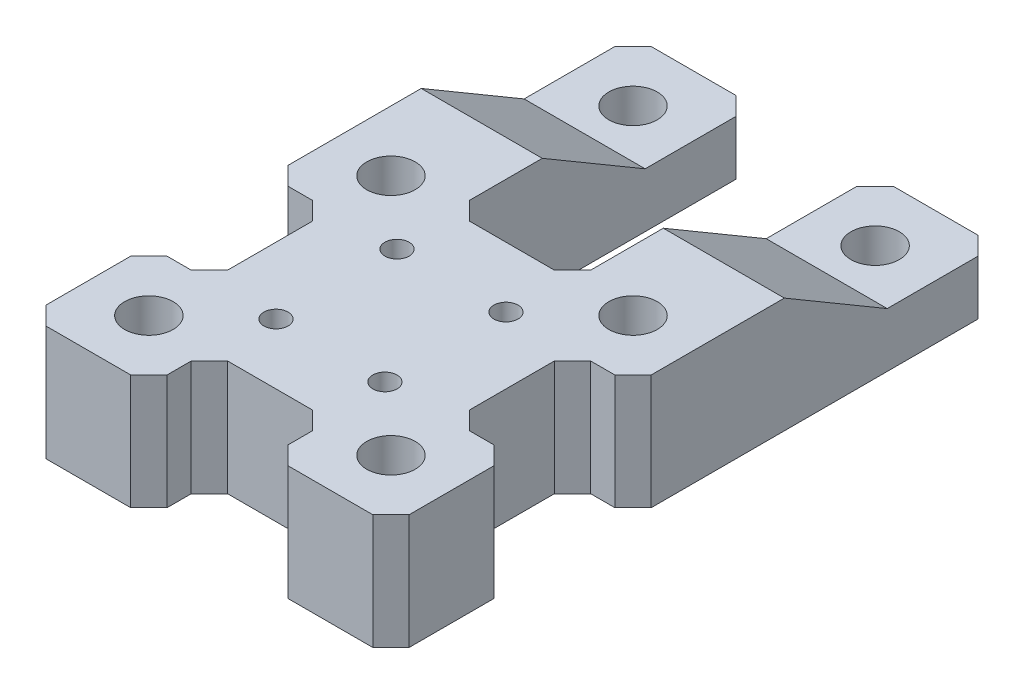
from build123d import *

# Parameters (mm, degrees)
SKETCH_1_W               = 60
SKETCH_1_H               = 100
SKETCH_1_R               = 4
SKETCH_1_R_2             = 2
EXTRUDE_1_DEPTH          = 19
SKETCH_3_W               = 20
SKETCH_3_H               = 50
SKETCH_3_H_2             = 10
SKETCH_3_W_2             = 10
SKETCH_3_H_3             = 20
CUT_EXTRUDE_1_DEPTH      = 62.326992426
CHAMFER_1_SIZE           = 3
CUT_EXTRUDE_2_DEPTH      = 62.326992426
CUT_EXTRUDE_2_DEPTH_BACK = 62.326992426


with BuildPart() as part:
    # 草图1 → 凸台-拉伸1 (new body)
    with BuildSketch(Plane(origin=(0, 0, 0), x_dir=(1, 0, 0), z_dir=(0, 1, 0))):
        Rectangle(SKETCH_1_W, SKETCH_1_H)
        with Locations(Location((-20, 0, 0), (0, 0, 270))):
            Circle(SKETCH_1_R, mode=Mode.SUBTRACT)
        with Locations(Location((20, 0, 0), (0, 0, 270))):
            Circle(SKETCH_1_R, mode=Mode.SUBTRACT)
        with Locations(Location((-20, -40, 0), (0, 0, 270))):
            Circle(SKETCH_1_R, mode=Mode.SUBTRACT)
        with Locations(Location((20, -40, 0), (0, 0, 270))):
            Circle(SKETCH_1_R, mode=Mode.SUBTRACT)
        with Locations(Location((-20, 40, 0), (0, 0, 270))):
            Circle(SKETCH_1_R, mode=Mode.SUBTRACT)
        with Locations(Location((20, 40, 0), (0, 0, 270))):
            Circle(SKETCH_1_R, mode=Mode.SUBTRACT)
        with Locations(Location((-9, -30, 0), (0, 0, 270))):
            Circle(SKETCH_1_R_2, mode=Mode.SUBTRACT)
        with Locations(Location((9, -30, 0), (0, 0, 270))):
            Circle(SKETCH_1_R_2, mode=Mode.SUBTRACT)
        with Locations(Location((-9, -10, 0), (0, 0, 270))):
            Circle(SKETCH_1_R_2, mode=Mode.SUBTRACT)
        with Locations(Location((9, -10, 0), (0, 0, 270))):
            Circle(SKETCH_1_R_2, mode=Mode.SUBTRACT)
    extrude(amount=EXTRUDE_1_DEPTH)

    # 草图3 → 切除-拉伸1 (cut, through all)
    with BuildSketch(Plane(origin=(0, 0, 0), x_dir=(1, 0, 0), z_dir=(0, 1, 0))):
        with Locations((0, 25)):
            Rectangle(SKETCH_3_W, SKETCH_3_H)
        with Locations((0, -45)):
            Rectangle(SKETCH_3_W, SKETCH_3_H_2)
        with Locations((-25, -20)):
            Rectangle(SKETCH_3_W_2, SKETCH_3_H_3)
        with Locations((25, -20)):
            Rectangle(SKETCH_3_W_2, SKETCH_3_H_3)
    extrude(amount=CUT_EXTRUDE_1_DEPTH, mode=Mode.SUBTRACT)

    # 倒角1
    chamfer_1_edges = [part.edges().sort_by_distance(p)[0] for p in [
        (-10, 9.5, -50),
        (-10, 9.5, 0),
        (10, 9.5, 0),
        (10, 9.5, -50),
        (-30, 9.5, -50),
        (30, 9.5, -50),
        (-10, 9.5, 40),
        (-10, 9.5, 50),
        (30, 9.5, 50),
        (10, 9.5, 50),
        (10, 9.5, 40),
        (-30, 9.5, 50),
        (-30, 9.5, 10),
        (-30, 9.5, 30),
        (-20, 9.5, 30),
        (-20, 9.5, 10),
        (30, 9.5, 30),
        (30, 9.5, 10),
        (20, 9.5, 10),
        (20, 9.5, 30),
    ]]
    chamfer(chamfer_1_edges, length=CHAMFER_1_SIZE)

    # 草图4 → 切除-拉伸2 (cut, two sides: drawn at the far end of the back side and taken through both)
    with BuildSketch(Plane(origin=(0, 0, 0), x_dir=(0, 0, -1), z_dir=(1, 0, 0)).offset(-CUT_EXTRUDE_2_DEPTH_BACK)):
        Polygon((15, 19), (32, 9), (50, 9), (50, 19), align=None)
    extrude(amount=CUT_EXTRUDE_2_DEPTH + CUT_EXTRUDE_2_DEPTH_BACK, mode=Mode.SUBTRACT)


solid = part.part
